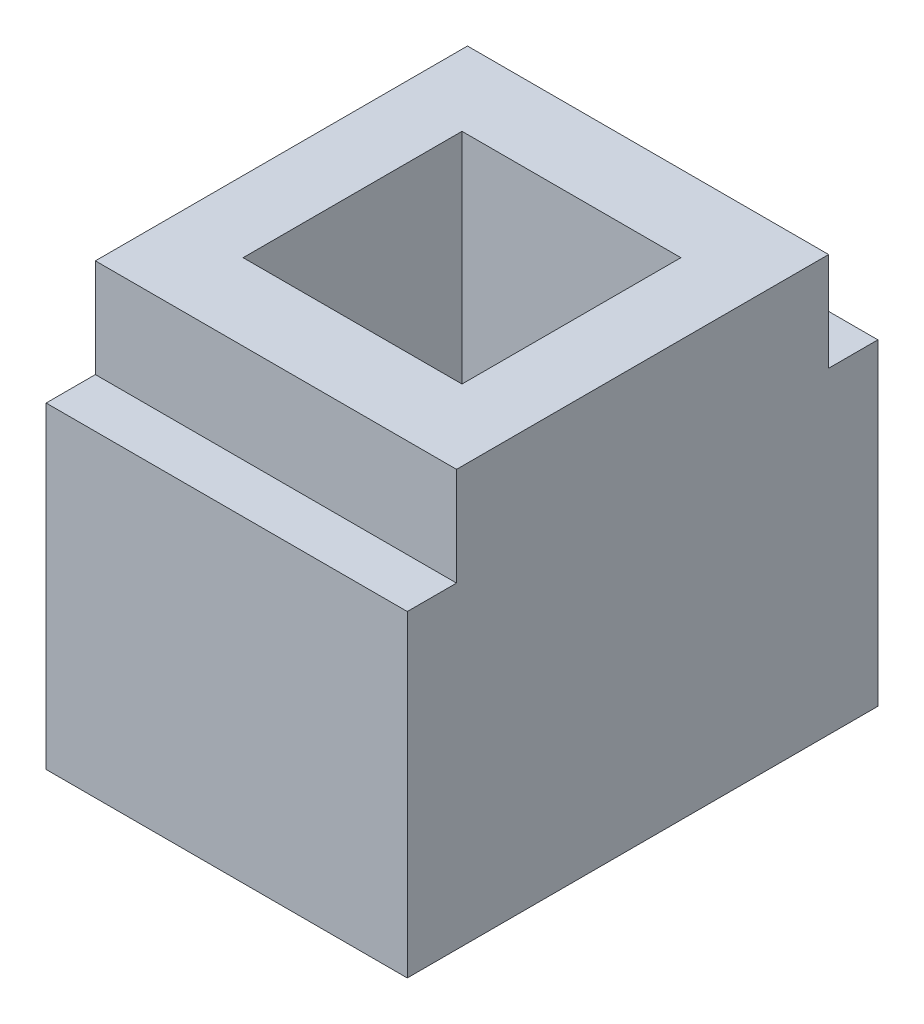
from build123d import *

# Parameters (mm, degrees)
SALIENTE_EXTRUIR1_DEPTH = 33
CROQUIS2_W              = 40
CROQUIS2_H              = 40
CORTAR_EXTRUIR1_DEPTH   = 94.348808241


with BuildPart() as part:
    # Croquis1 → Saliente-Extruir1 (new, symmetric)
    with BuildSketch(Plane(origin=(0, 0, 0), x_dir=(0, 0, -1), z_dir=(1, 0, 0))):
        Polygon((34, 38), (-34, 38), (-34, 20), (-43, 20), (-43, -38), (43, -38), (43, 20), (34, 20), align=None)
    extrude(amount=SALIENTE_EXTRUIR1_DEPTH, both=True)

    # Croquis2 → Cortar-Extruir1 (cut, through all)
    with BuildSketch(Plane(origin=(0, 38, 0), x_dir=(1, 0, 0), z_dir=(0, 1, 0))):
        Rectangle(CROQUIS2_W, CROQUIS2_H)
    extrude(amount=-CORTAR_EXTRUIR1_DEPTH, mode=Mode.SUBTRACT)


solid = part.part
